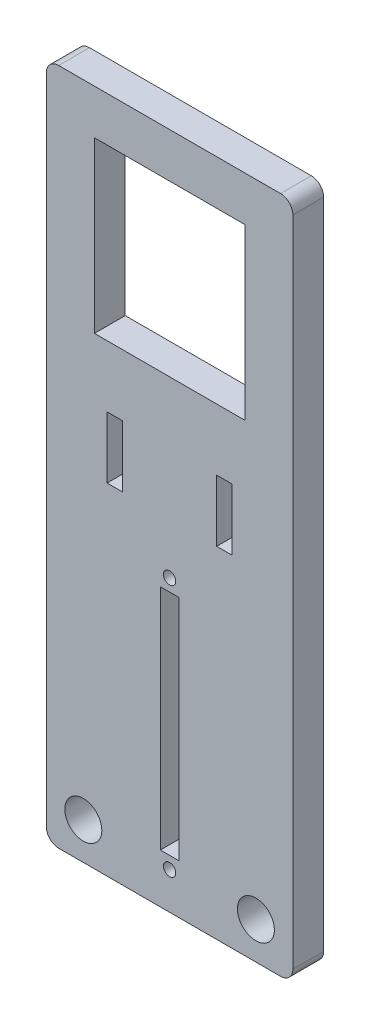
from build123d import *

# Parameters (mm, degrees)
MODEL_W             = 40
MODEL_H             = 110
MODEL_R             = 3
MODEL_R_2           = 1
MODEL_W_2           = 3
MODEL_H_2           = 37
MODEL_W_3           = 24.4
MODEL_H_3           = 27.5
MODEL_W_4           = 2.5
MODEL_H_4           = 10
BOSS_EXTRUDE1_DEPTH = 5
FILLET1_R           = 2


with BuildPart() as part:
    # Model → Boss-Extrude1 (new body)
    with BuildSketch(Plane.XY):
        with Locations((20, 55)):
            Rectangle(MODEL_W, MODEL_H)
        with Locations((34, 6)):
            Circle(MODEL_R, mode=Mode.SUBTRACT)
        with Locations((6, 6)):
            Circle(MODEL_R, mode=Mode.SUBTRACT)
        with Locations((20, 6)):
            Circle(MODEL_R_2, mode=Mode.SUBTRACT)
        with Locations((20, 47)):
            Circle(MODEL_R_2, mode=Mode.SUBTRACT)
        with Locations((20, 26.5)):
            Rectangle(MODEL_W_2, MODEL_H_2, mode=Mode.SUBTRACT)
        with Locations((20, 89)):
            Rectangle(MODEL_W_3, MODEL_H_3, mode=Mode.SUBTRACT)
        with Locations((11.11, 60.25)):
            Rectangle(MODEL_W_4, MODEL_H_4, mode=Mode.SUBTRACT)
        with Locations((28.89, 60.25)):
            Rectangle(MODEL_W_4, MODEL_H_4, mode=Mode.SUBTRACT)
    extrude(amount=BOSS_EXTRUDE1_DEPTH)

    # Fillet1
    fillet1_edges = [part.edges().sort_by_distance(p)[0] for p in [
        (0, 0, 2.5),
        (0, 110, 2.5),
        (40, 110, 2.5),
        (40, 0, 2.5),
    ]]
    fillet(fillet1_edges, radius=FILLET1_R)


solid = part.part
